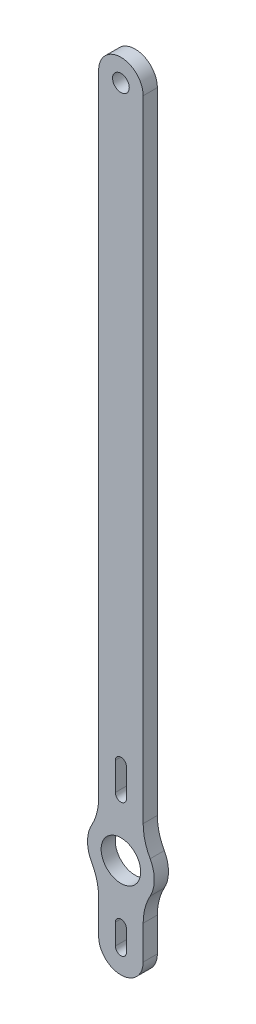
from build123d import *

# Parameters (mm, degrees)
MODEL_R             = 3.55
MODEL_R_2           = 1.5
BOSS_EXTRUDE1_DEPTH = 2.55


with BuildPart() as part:
    # Model → Boss-Extrude1 (new body)
    with BuildSketch(Plane.XY):
        with BuildLine():
            Line((-4, 121), (-4, 7.745966692))
            ThreePointArc((-4, 7.745966692), (-4.317541634, 5.245966692), (-5.25, 2.90473751))
            ThreePointArc((-5.25, 2.90473751), (-6, 0), (-5.25, -2.90473751))
            ThreePointArc((-5.25, -2.90473751), (-4.317541634, -5.245966692), (-4, -7.745966692))
            Line((-4, -7.745966692), (-4, -13.8))
            ThreePointArc((-4, -13.8), (0, -17.8), (4, -13.8))
            Line((4, -13.8), (4, -7.745966692))
            ThreePointArc((4, -7.745966692), (4.317541634, -5.245966692), (5.25, -2.90473751))
            ThreePointArc((5.25, -2.90473751), (6, 0), (5.25, 2.90473751))
            ThreePointArc((5.25, 2.90473751), (4.317541634, 5.245966692), (4, 7.745966692))
            Line((4, 7.745966692), (4, 121))
            ThreePointArc((4, 121), (0, 125), (-4, 121))
        make_face()
        Circle(MODEL_R, mode=Mode.SUBTRACT)
        with Locations((0, 121)):
            Circle(MODEL_R_2, mode=Mode.SUBTRACT)
        with BuildLine():
            Line((-1, -10.1), (-1, -13.8))
            ThreePointArc((-1, -13.8), (0, -14.8), (1, -13.8))
            Line((1, -13.8), (1, -10.1))
            ThreePointArc((1, -10.1), (0, -9.1), (-1, -10.1))
        make_face(mode=Mode.SUBTRACT)
        with BuildLine():
            Line((-1, 15.1), (-1, 10.1))
            ThreePointArc((-1, 10.1), (0, 9.1), (1, 10.1))
            Line((1, 10.1), (1, 15.1))
            ThreePointArc((1, 15.1), (0, 16.1), (-1, 15.1))
        make_face(mode=Mode.SUBTRACT)
    extrude(amount=BOSS_EXTRUDE1_DEPTH)


solid = part.part
